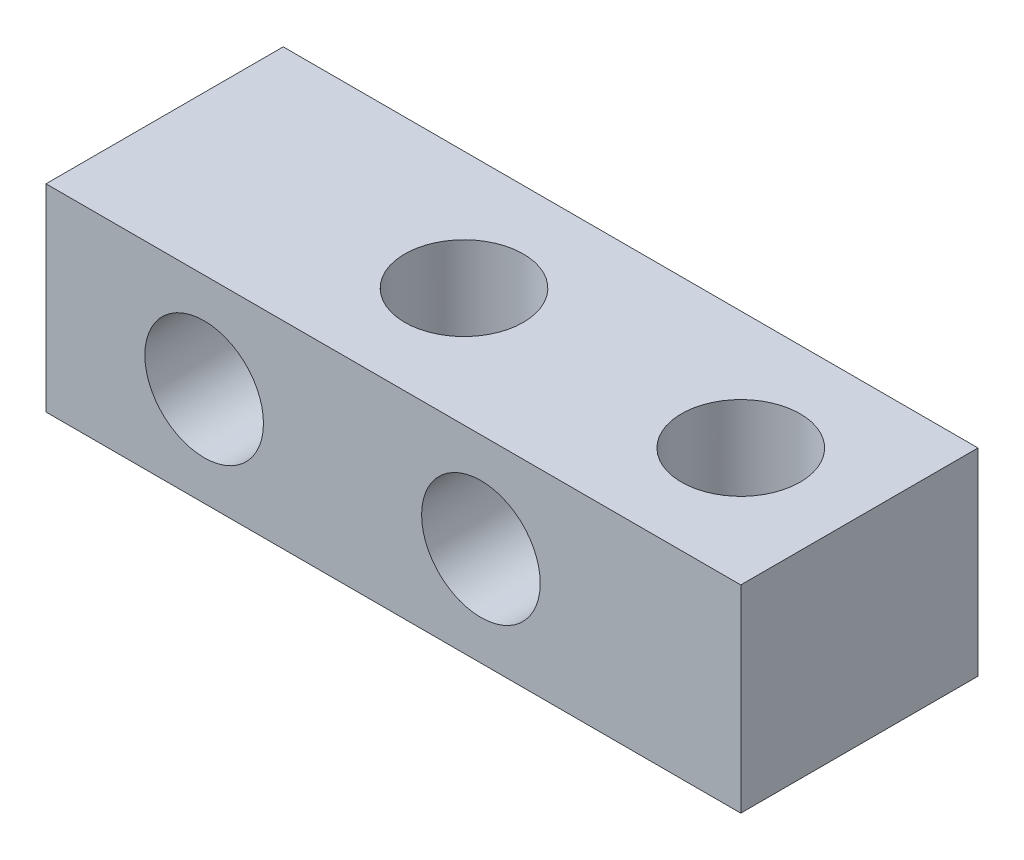
from build123d import *

# Parameters (mm, degrees)
SKETCH_5_W               = 17.572810229
SKETCH_5_H               = 5
EXTRUDE_1_DEPTH          = 6
CUT_EXTRUDE_1_DEPTH      = 50.115553238
CUT_EXTRUDE_1_DEPTH_BACK = 50.115553238
SKETCH_6_R               = 1.5
CUT_EXTRUDE_2_DEPTH      = 50.168435707
CUT_EXTRUDE_2_DEPTH_BACK = 50.168435707
SKETCH_7_R               = 1.5


with BuildPart() as part:
    # 草图5 → 凸台-拉伸1 (new body)
    with BuildSketch(Plane.XY):
        with Locations((-39.757750763, 1.95)):
            Rectangle(SKETCH_5_W, SKETCH_5_H)
    extrude(amount=EXTRUDE_1_DEPTH)

    # 草图6 → 切除-拉伸1 (cut, two sides: drawn at the far end of the back side and taken through both)
    with BuildSketch(Plane.XY.offset(6).offset(-CUT_EXTRUDE_1_DEPTH_BACK)):
        with Locations((-37.544155877, 1.95)):
            Circle(SKETCH_6_R)
        with Locations((-44.544155877, 1.95)):
            Circle(SKETCH_6_R)
    extrude(amount=CUT_EXTRUDE_1_DEPTH + CUT_EXTRUDE_1_DEPTH_BACK, mode=Mode.SUBTRACT)

    # 草图7 → 切除-拉伸2 (cut, two sides: drawn at the far end of the back side and taken through both)
    with BuildSketch(Plane.XZ.offset(0.55).offset(-CUT_EXTRUDE_2_DEPTH_BACK)):
        with Locations((-40.971345648, 3)):
            Circle(SKETCH_7_R)
        with Locations((-33.971345648, 3)):
            Circle(SKETCH_7_R)
    extrude(amount=CUT_EXTRUDE_2_DEPTH + CUT_EXTRUDE_2_DEPTH_BACK, mode=Mode.SUBTRACT)


solid = part.part
